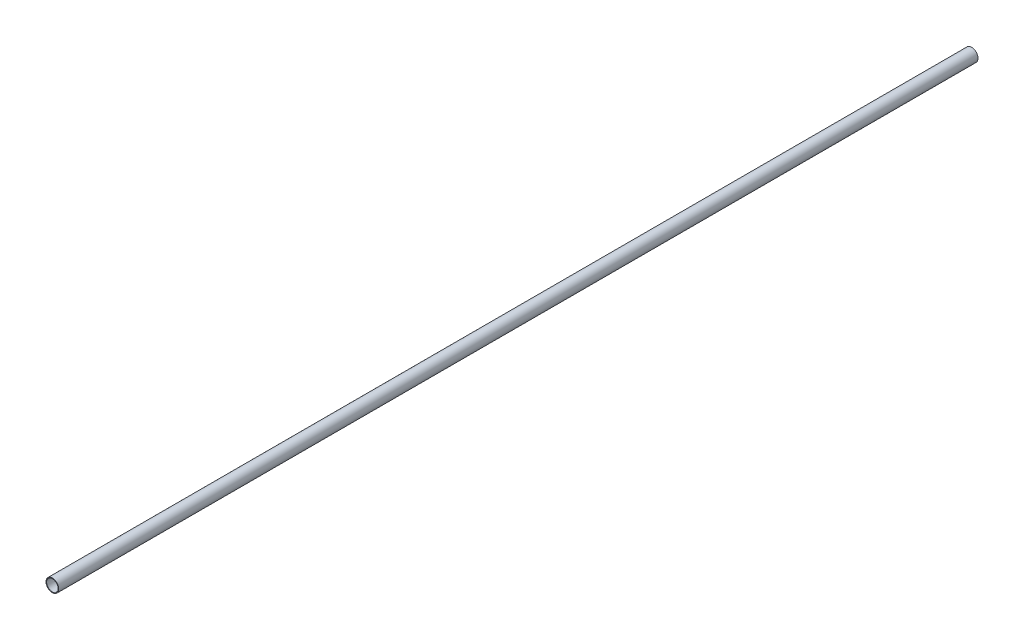
from build123d import *

# Parameters (mm, degrees)
BOSS_EXTRUDE1_DEPTH      = 914.4
BOSS_EXTRUDE1_DEPTH_BACK = 914.4
SKETCH3_R                = 12.7
SKETCH3_R_2              = 11.4554


with BuildPart() as part:
    # Sketch3 → Boss-Extrude1 (new, two sides: drawn at the far end of the back side and taken through both)
    with BuildSketch(Plane.XY.offset(-BOSS_EXTRUDE1_DEPTH_BACK)):
        Circle(SKETCH3_R)
        Circle(SKETCH3_R_2, mode=Mode.SUBTRACT)
    extrude(amount=BOSS_EXTRUDE1_DEPTH + BOSS_EXTRUDE1_DEPTH_BACK)


solid = part.part
